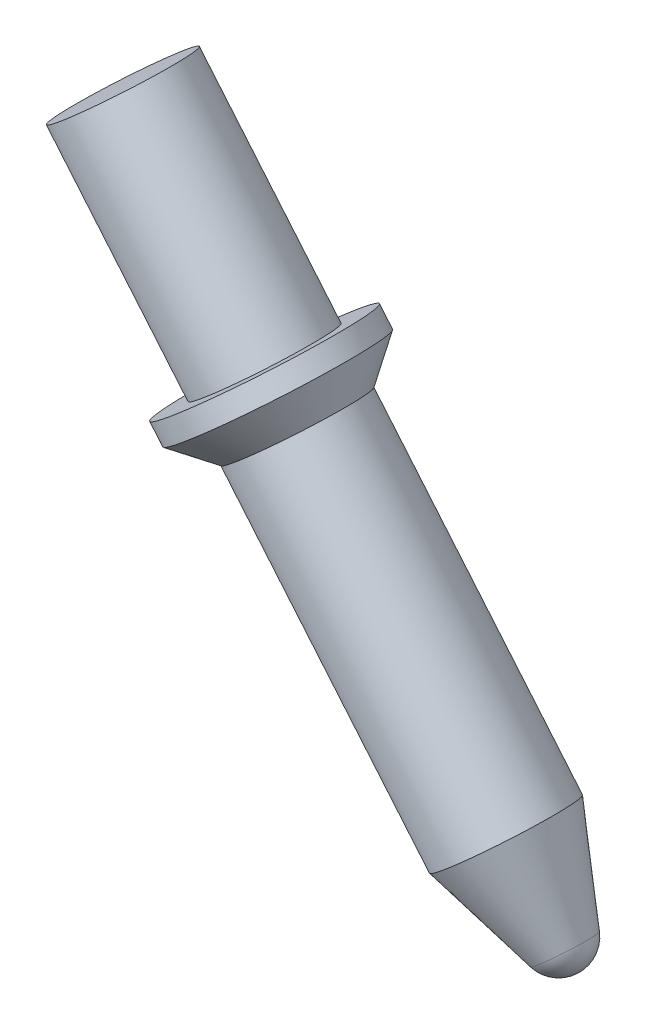
from build123d import *


with BuildPart() as part:
    # Sketch2 → Revolve1 (revolve)
    with BuildSketch(Plane.XY):
        with BuildLine():
            Line((25.047699583, 26.952680264), (36.149927178, 13.721560642))
            Line((36.149927178, 13.721560642), (37.97893489, 15.256280339))
            Line((37.97893489, 15.256280339), (39.007523623, 14.030456021))
            Line((39.007523623, 14.030456021), (38.713235608, 10.666728612))
            Line((38.713235608, 10.666728612), (55.059298025, -8.813749999))
            Line((55.059298025, -8.813749999), (57.671314579, -15.990206501))
            ThreePointArc((57.671314579, -15.990206501), (57.731349183, -17.365224991), (56.991848446, -18.526008632))
            Line((56.991848446, -18.526008632), (21.399412923, 23.891404273))
            Line((21.399412923, 23.891404273), (25.047699583, 26.952680264))
        make_face()
    revolve(axis=Axis((56.991848446, -18.526008632, 0), (-0.6427876096865393, 0.7660444431189782, 0)))


solid = part.part
